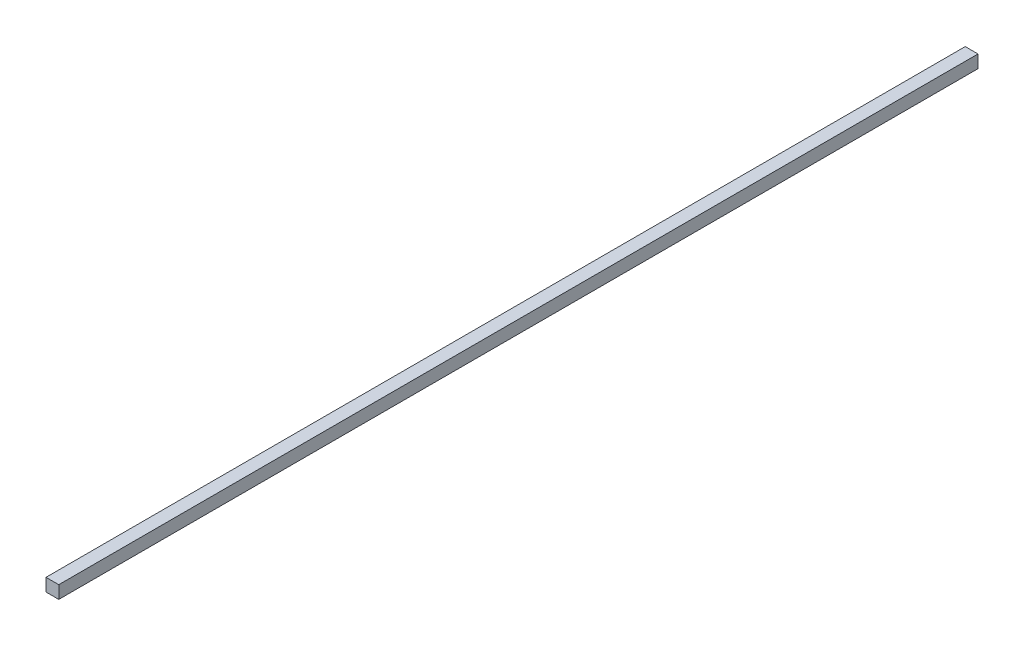
from build123d import *

# Parameters (mm, degrees)
SKETCH1_W           = 20
SKETCH1_H           = 20
BOSS_EXTRUDE1_DEPTH = 1440


with BuildPart() as part:
    # Sketch1 → Boss-Extrude1 (new body)
    with BuildSketch(Plane.XY):
        Rectangle(SKETCH1_W, SKETCH1_H)
    extrude(amount=BOSS_EXTRUDE1_DEPTH)


solid = part.part
